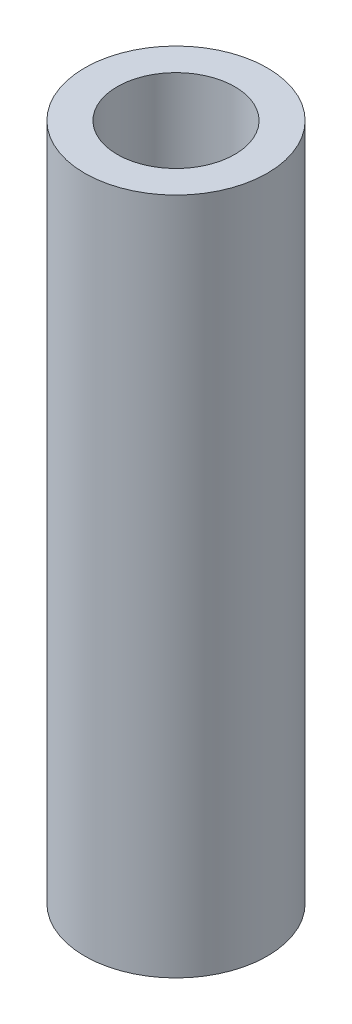
from build123d import *

# Parameters (mm, degrees)
SKETCH1_R           = 10.1
SKETCH1_R_2         = 6.5
BOSS_EXTRUDE1_DEPTH = 75


with BuildPart() as part:
    # Sketch1 → Boss-Extrude1 (new body)
    with BuildSketch(Plane(origin=(0, 0, 0), x_dir=(1, 0, 0), z_dir=(0, 1, 0))):
        with Locations(Location((0, 0, 0), (0, 0, 270))):
            Circle(SKETCH1_R)
        with Locations(Location((0, 0, 0), (0, 0, 270))):
            Circle(SKETCH1_R_2, mode=Mode.SUBTRACT)
    extrude(amount=BOSS_EXTRUDE1_DEPTH)


solid = part.part
